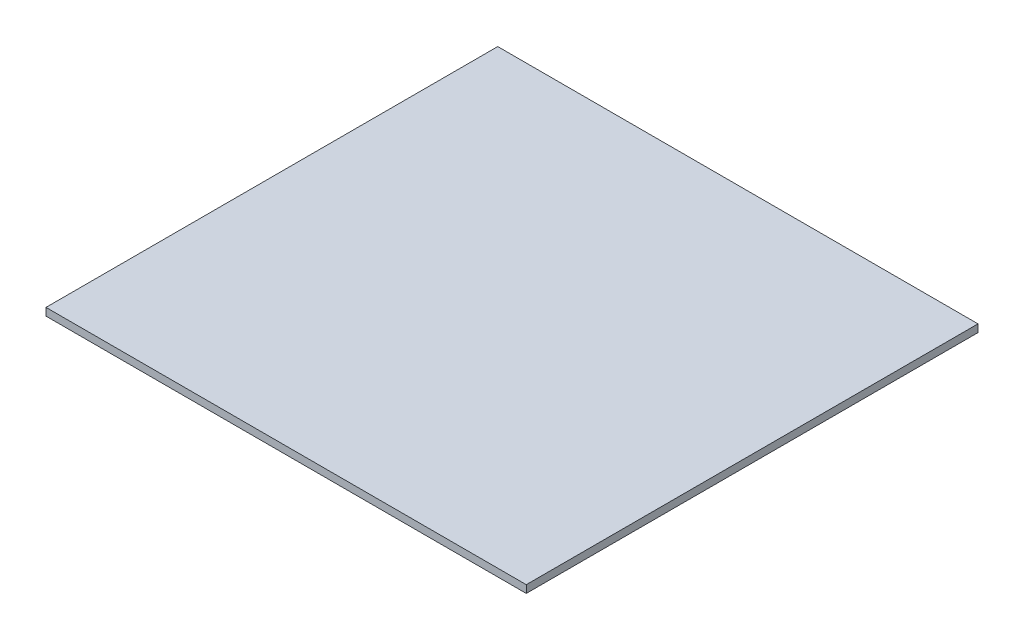
from build123d import *

# Parameters (mm, degrees)
SKETCH1_W           = 202
SKETCH1_H           = 3.2
BOSS_EXTRUDE1_DEPTH = 190


with BuildPart() as part:
    # Sketch1 → Boss-Extrude1 (new body)
    with BuildSketch(Plane.XY):
        Rectangle(SKETCH1_W, SKETCH1_H)
    extrude(amount=BOSS_EXTRUDE1_DEPTH)


solid = part.part
